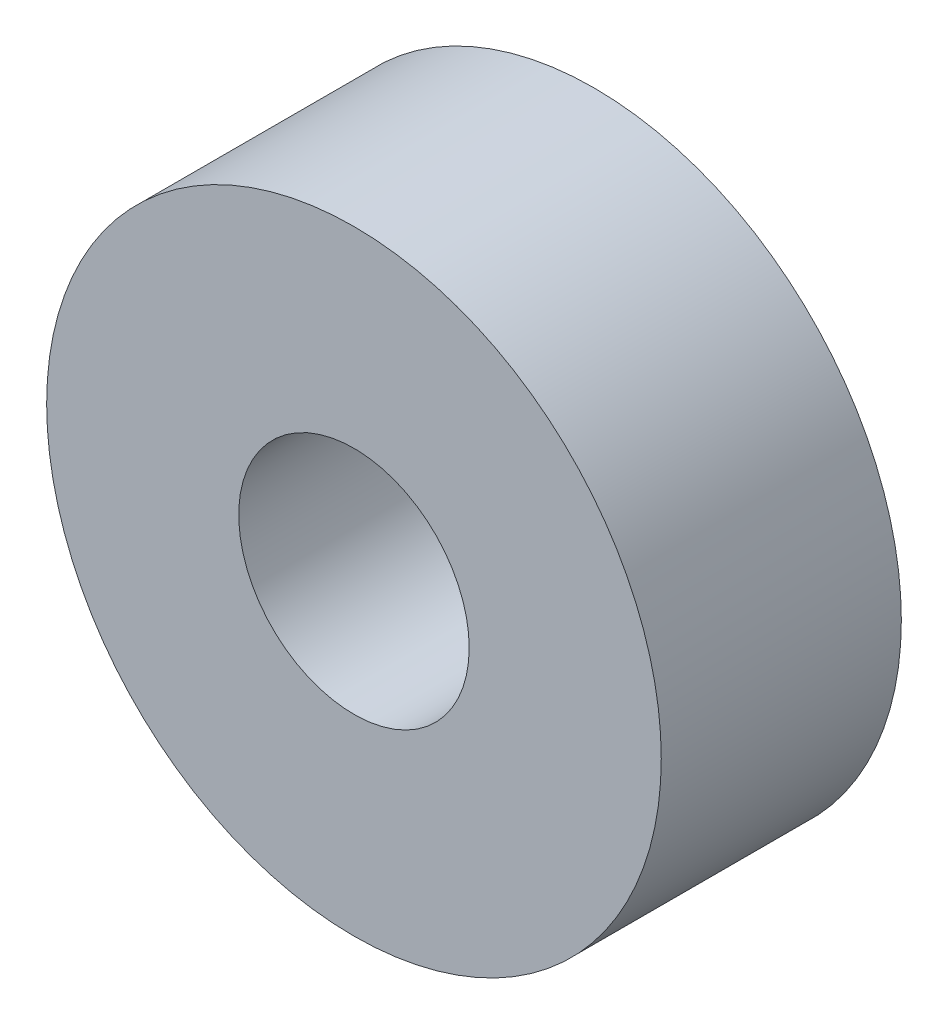
from build123d import *

# Parameters (mm, degrees)
SKETCH1_R           = 6.4
SKETCH1_R_2         = 2.4
EXTRUDE_THIN1_DEPTH = 5


with BuildPart() as part:
    # Sketch1 → Extrude-Thin1 (new body)
    with BuildSketch(Plane.XY):
        Circle(SKETCH1_R)
        Circle(SKETCH1_R_2, mode=Mode.SUBTRACT)
    extrude(amount=EXTRUDE_THIN1_DEPTH)


solid = part.part
